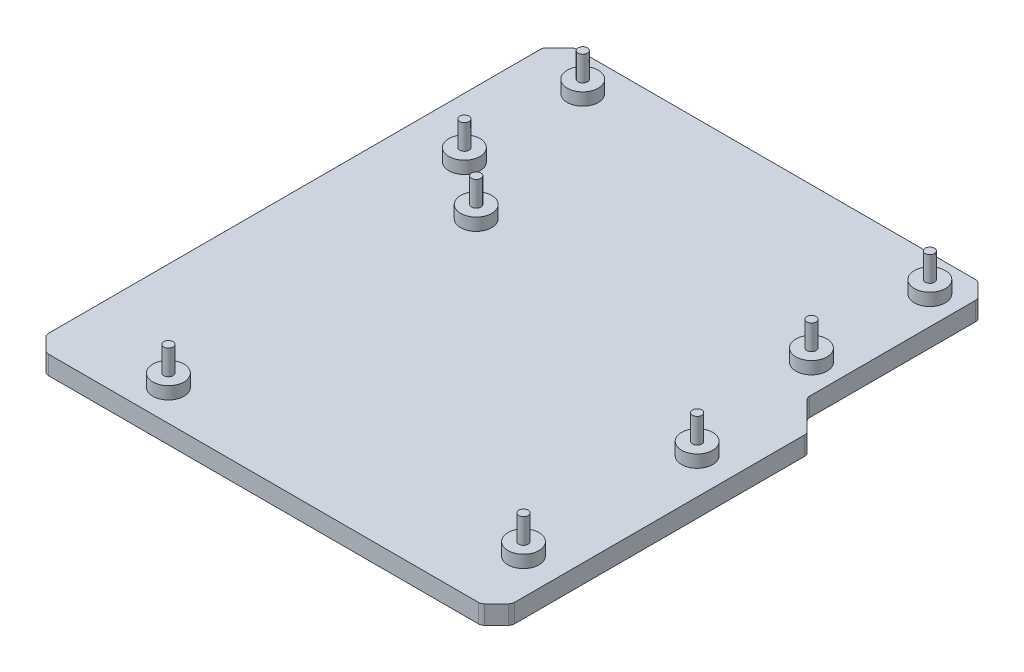
from build123d import *

# Parameters (mm, degrees)
SKETCH1_W           = 75
SKETCH1_H           = 85
BOSS_EXTRUDE1_DEPTH = 3
SKETCH2_R           = 2.5
BOSS_EXTRUDE2_DEPTH = 2
SKETCH3_R           = 0.75
BOSS_EXTRUDE3_DEPTH = 4
CUT_EXTRUDE1_REACH  = 58.996
CHAMFER3_SIZE       = 2.5
FILLET2_R           = 1
SKETCH5_W           = 9.85
SKETCH5_H           = 3.85
BOSS_EXTRUDE4_DEPTH = 3
FILLET3_R           = 2
SKETCH6_W           = 1.5
SKETCH6_H           = 3
CUT_EXTRUDE2_DEPTH  = 69.085465593


with BuildPart() as part:
    # Sketch1 → Boss-Extrude1 (new body)
    with BuildSketch(Plane(origin=(0, 0, 0), x_dir=(1, 0, 0), z_dir=(0, 1, 0))):
        Rectangle(SKETCH1_W, SKETCH1_H)
    extrude(amount=BOSS_EXTRUDE1_DEPTH)

    # Sketch2 → Boss-Extrude2 (add)
    with BuildSketch(Plane(origin=(0, 3, 0), x_dir=(1, 0, 0), z_dir=(0, 1, 0))):
        with Locations(Location((27.93, 36.82, 0), (0, 0, 270))):
            Circle(SKETCH2_R)
        with Locations(Location((27.93, 17.77, 0), (0, 0, 270))):
            Circle(SKETCH2_R)
        with Locations(Location((-27.93, 17.77, 0), (0, 0, 90))):
            Circle(SKETCH2_R)
        with Locations(Location((-27.93, 36.82, 0), (0, 0, 90))):
            Circle(SKETCH2_R)
        with Locations(Location((-19.05, 10.79, 0), (0, 0, 90))):
            Circle(SKETCH2_R)
        with Locations(Location((-20.32, -37.48, 0), (0, 0, 90))):
            Circle(SKETCH2_R)
        with Locations(Location((31.75, -4.45, 0), (0, 0, 270))):
            Circle(SKETCH2_R)
        with Locations(Location((31.75, -32.4, 0), (0, 0, 270))):
            Circle(SKETCH2_R)
    extrude(amount=BOSS_EXTRUDE2_DEPTH)

    # Sketch3 → Boss-Extrude3 (add)
    with BuildSketch(Plane(origin=(0, 5, 0), x_dir=(1, 0, 0), z_dir=(0, 1, 0))):
        with Locations(Location((-27.93, 36.82, 0), (0, 0, 270))):
            Circle(SKETCH3_R)
        with Locations(Location((27.93, 36.82, 0), (0, 0, 90))):
            Circle(SKETCH3_R)
        with Locations(Location((27.93, 17.77, 0), (0, 0, 270))):
            Circle(SKETCH3_R)
        with Locations(Location((-27.93, 17.77, 0), (0, 0, 90))):
            Circle(SKETCH3_R)
        with Locations(Location((-19.05, 10.79, 0), (0, 0, 270))):
            Circle(SKETCH3_R)
        with Locations(Location((31.75, -4.45, 0), (0, 0, 270))):
            Circle(SKETCH3_R)
        with Locations(Location((-20.32, -37.48, 0), (0, 0, 270))):
            Circle(SKETCH3_R)
        with Locations(Location((31.75, -32.4, 0), (0, 0, 270))):
            Circle(SKETCH3_R)
    extrude(amount=BOSS_EXTRUDE3_DEPTH)

    # Sketch4 → Cut-Extrude1 (cut, up to next)
    with BuildSketch(Plane(origin=(0, 3, 0), x_dir=(1, 0, 0), z_dir=(0, 1, 0)), mode=Mode.PRIVATE) as cut_extrude1_sk1:
        Polygon((37.5, 7.5), (32.5, 12.5), (32.5, 42.5), (37.5, 42.5), align=None)
    cut_extrude1_tool1 = extrude(cut_extrude1_sk1.sketch, amount=-CUT_EXTRUDE1_REACH, mode=Mode.PRIVATE) & part.part
    add(cut_extrude1_tool1.solids().sort_by_distance((35.064103, 3, -26.217949))[0], mode=Mode.SUBTRACT)

    # Chamfer3
    chamfer3_edges = [part.edges().sort_by_distance(p)[0] for p in [
        (37.5, 1.5, 42.5),
        (-37.5, 1.5, 42.5),
        (-37.5, 1.5, -42.5),
        (32.5, 1.5, -42.5),
    ]]
    chamfer(chamfer3_edges, length=CHAMFER3_SIZE)

    # Fillet2
    fillet2_edges = [part.edges().sort_by_distance(p)[0] for p in [
        (-37.5, 1.5, -40),
        (-37.5, 1.5, 40),
        (37.5, 1.5, 40),
        (32.5, 1.5, -40),
        (-35, 1.5, -42.5),
        (30, 1.5, -42.5),
        (37.5, 1.5, -7.5),
        (32.5, 1.5, -12.5),
        (35, 1.5, 42.5),
        (-35, 1.5, 42.5),
    ]]
    fillet(fillet2_edges, radius=FILLET2_R)

    # Sketch5 → Boss-Extrude4 (add)
    with BuildSketch(Plane.XZ):
        with Locations((10, -9.0625)):
            Rectangle(SKETCH5_W, SKETCH5_H)
        with Locations((-10, -9.0625)):
            Rectangle(SKETCH5_W, SKETCH5_H)
    extrude(amount=BOSS_EXTRUDE4_DEPTH)

    # Fillet3
    fillet3_edges = [part.edges().sort_by_distance(p)[0] for p in [
        (10, 0, -7.1375),
        (10, 0, -10.9875),
        (-10, 0, -10.9875),
        (-10, 0, -7.1375),
    ]]
    fillet(fillet3_edges, radius=FILLET3_R)

    # Sketch6 → Cut-Extrude2 (cut, through all)
    with BuildSketch(Plane.ZY.offset(14.925)):
        with Locations((-9.1375, -1.5)):
            Rectangle(SKETCH6_W, SKETCH6_H)
    extrude(amount=-CUT_EXTRUDE2_DEPTH, mode=Mode.SUBTRACT)


solid = part.part
